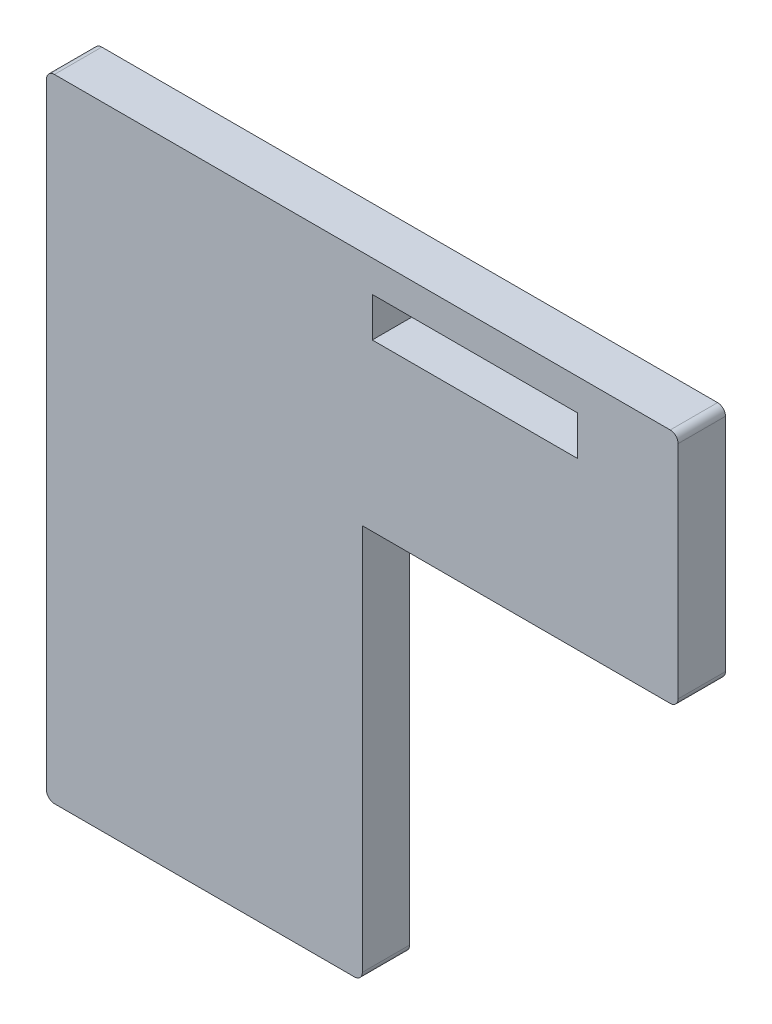
from build123d import *

# Parameters (mm, degrees)
Y_KSEKLIK_EKSTR_ZYON1_DEPTH = 3
RADYUS1_R                   = 0.5
KES_EKSTR_ZYON2_REACH       = 38.886
IZIM6_W                     = 13
IZIM6_H                     = 2.5


with BuildPart() as part:
    # Çizim1 → Yükseklik-Ekstrüzyon1 (new body)
    with BuildSketch(Plane.XY):
        Polygon((10, 21.25), (30, 21.25), (30, 6.25), (10, 6.25), (10, -18.75), (-10, -18.75), (-10, 21.25), align=None)
    extrude(amount=Y_KSEKLIK_EKSTR_ZYON1_DEPTH)

    # Radyus1
    radyus1_edges = [part.edges().sort_by_distance(p)[0] for p in [
        (-10, 21.25, 1.5),
        (30, 21.25, 1.5),
        (30, 6.25, 1.5),
        (10, -18.75, 1.5),
        (-10, -18.75, 1.5),
    ]]
    fillet(radyus1_edges, radius=RADYUS1_R)

    # Çizim6 → Kes-Ekstrüzyon2 (cut, up to next)
    with BuildSketch(Plane(origin=(0, 0, 0), x_dir=(-1, 0, 0), z_dir=(0, 0, -1)), mode=Mode.PRIVATE) as kes_ekstr_zyon2_sk1:
        with Locations((-17.130228212, 18)):
            Rectangle(IZIM6_W, IZIM6_H)
    kes_ekstr_zyon2_tool1 = extrude(kes_ekstr_zyon2_sk1.sketch, amount=-KES_EKSTR_ZYON2_REACH, mode=Mode.PRIVATE) & part.part
    add(kes_ekstr_zyon2_tool1.solids().sort_by_distance((17.130228, 18, 0))[0], mode=Mode.SUBTRACT)


solid = part.part
